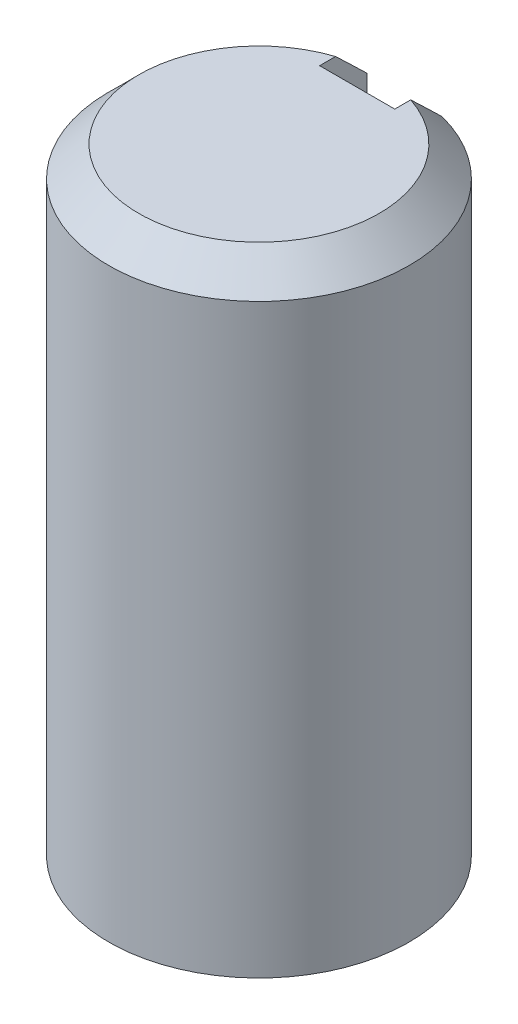
from build123d import *

# Parameters (mm, degrees)
SKETCH_1_R          = 10
EXTRUDE_1_DEPTH     = 41
SKETCH_2_W          = 5
SKETCH_2_H          = 3.914156893
CUT_EXTRUDE_1_DEPTH = 48
CHAMFER_1_SIZE      = 2


with BuildPart() as part:
    # Эскиз1 → Бобышка-Вытянуть1 (new body)
    with BuildSketch(Plane(origin=(0, 0, 0), x_dir=(1, 0, 0), z_dir=(0, 1, 0))):
        with Locations(Location((0, 0, 0), (0, 0, 270))):
            Circle(SKETCH_1_R)
    extrude(amount=EXTRUDE_1_DEPTH)

    # Эскиз2 → Вырез-Вытянуть1 (cut)
    with BuildSketch(Plane(origin=(0, 41, 0), x_dir=(1, 0, 0), z_dir=(0, 1, 0))):
        with Locations((0, 8.495426862)):
            Rectangle(SKETCH_2_W, SKETCH_2_H)
    extrude(amount=-CUT_EXTRUDE_1_DEPTH, mode=Mode.SUBTRACT)

    # Фаска1
    chamfer_1_edges = [part.edges().sort_by_distance(p)[0] for p in [
        (0, 41, 10),
    ]]
    chamfer(chamfer_1_edges, length=CHAMFER_1_SIZE)


solid = part.part
